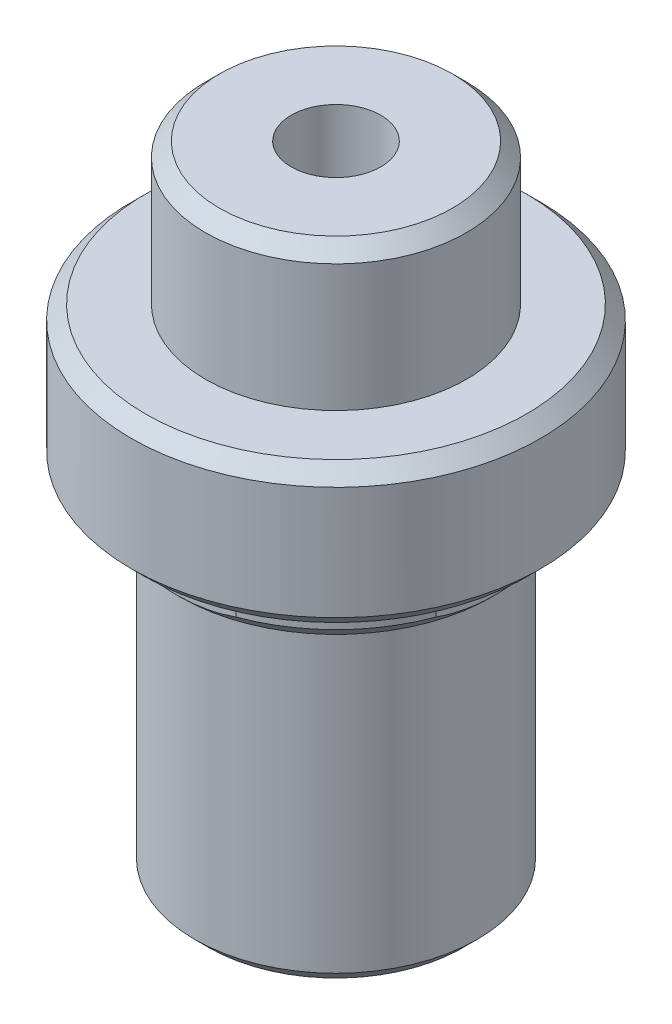
from build123d import *

# Parameters (mm, degrees)
CHAMFER1_SIZE       = 2
SKETCH2_OUTSIDE_W   = 84.354
SKETCH2_OUTSIDE_H   = 84.354
SKETCH2_OUTSIDE_W_2 = 45
SKETCH2_OUTSIDE_H_2 = 45
CUT_EXTRUDE1_DEPTH  = 65.668384857


with BuildPart() as part:
    # Sketch1 → Revolve2 (revolve)
    with BuildSketch(Plane.XY):
        Polygon((18.5, 0), (18.5, 20), (6.35, 20), (6.35, -70), (20, -70), (20, -25), (24, -25), (24, -20), (29, -20), (29, 0), align=None)
    revolve(axis=Axis((0, 38.250415552, 0), (0, -1, 0)))

    # Chamfer1
    chamfer1_edges = [part.edges().sort_by_distance(p)[0] for p in [
        (-18.5, 20, 0),
        (-29, 0, 0),
        (-20, -70, 0),
        (-24, -25, 0),
        (-29, -20, 0),
    ]]
    chamfer(chamfer1_edges, length=CHAMFER1_SIZE)

    # Sketch2 outside → Cut-Extrude1 (cut, through all)
    with BuildSketch(Plane.XZ.offset(20)):
        Rectangle(SKETCH2_OUTSIDE_W, SKETCH2_OUTSIDE_H)
        Rectangle(SKETCH2_OUTSIDE_W_2, SKETCH2_OUTSIDE_H_2, mode=Mode.SUBTRACT)
    extrude(amount=CUT_EXTRUDE1_DEPTH, mode=Mode.SUBTRACT)


solid = part.part
